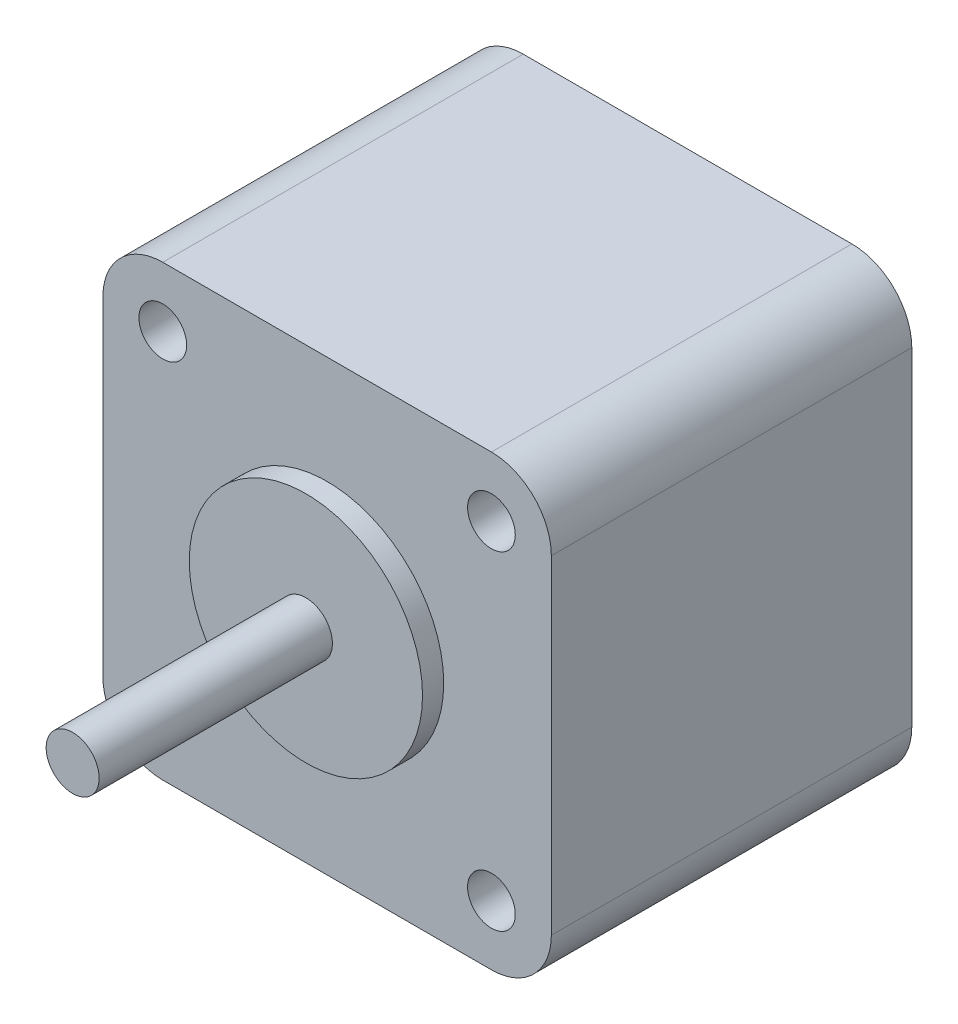
from build123d import *

# Parameters (mm, degrees)
SKETCH1_R           = 2.5
BOSS_EXTRUDE1_DEPTH = 24
SKETCH2_R           = 11
BOSS_EXTRUDE2_DEPTH = 2
BOSS_EXTRUDE3_DEPTH = 34
SKETCH5_R           = 2.25
CUT_EXTRUDE1_DEPTH  = 34


with BuildPart() as part:
    # Sketch1 → Boss-Extrude1 (new body)
    with BuildSketch(Plane.XY):
        Circle(SKETCH1_R)
    extrude(amount=BOSS_EXTRUDE1_DEPTH)

    # Sketch2 → Boss-Extrude2 (add)
    with BuildSketch(Plane.XY):
        Circle(SKETCH2_R)
    extrude(amount=BOSS_EXTRUDE2_DEPTH)

    # Sketch4 → Boss-Extrude3 (add)
    with BuildSketch(Plane(origin=(0, 0, 0), x_dir=(-1, 0, 0), z_dir=(0, 0, -1))):
        with BuildLine():
            Line((15.5, 21.15), (-15.5, 21.15))
            ThreePointArc((-15.5, 21.15), (-19.495153314, 19.495153314), (-21.15, 15.5))
            Line((-21.15, 15.5), (-21.15, -15.5))
            ThreePointArc((-21.15, -15.5), (-19.495153314, -19.495153314), (-15.5, -21.15))
            Line((-15.5, -21.15), (15.5, -21.15))
            ThreePointArc((15.5, -21.15), (19.495153314, -19.495153314), (21.15, -15.5))
            Line((21.15, -15.5), (21.15, 15.5))
            ThreePointArc((21.15, 15.5), (19.495153314, 19.495153314), (15.5, 21.15))
        make_face()
    extrude(amount=BOSS_EXTRUDE3_DEPTH)

    # Sketch5 → Cut-Extrude1 (cut)
    with BuildSketch(Plane(origin=(0, 0, -34), x_dir=(-1, 0, 0), z_dir=(0, 0, -1))):
        with Locations((-15.5, -15.5)):
            Circle(SKETCH5_R)
        with Locations(Location((15.5, -15.5, 0), (0, 0, 180))):
            Circle(SKETCH5_R)
        with Locations(Location((-15.5, 15.5, 0), (0, 0, 180))):
            Circle(SKETCH5_R)
        with Locations((15.5, 15.5)):
            Circle(SKETCH5_R)
    extrude(amount=-CUT_EXTRUDE1_DEPTH, mode=Mode.SUBTRACT)


solid = part.part
